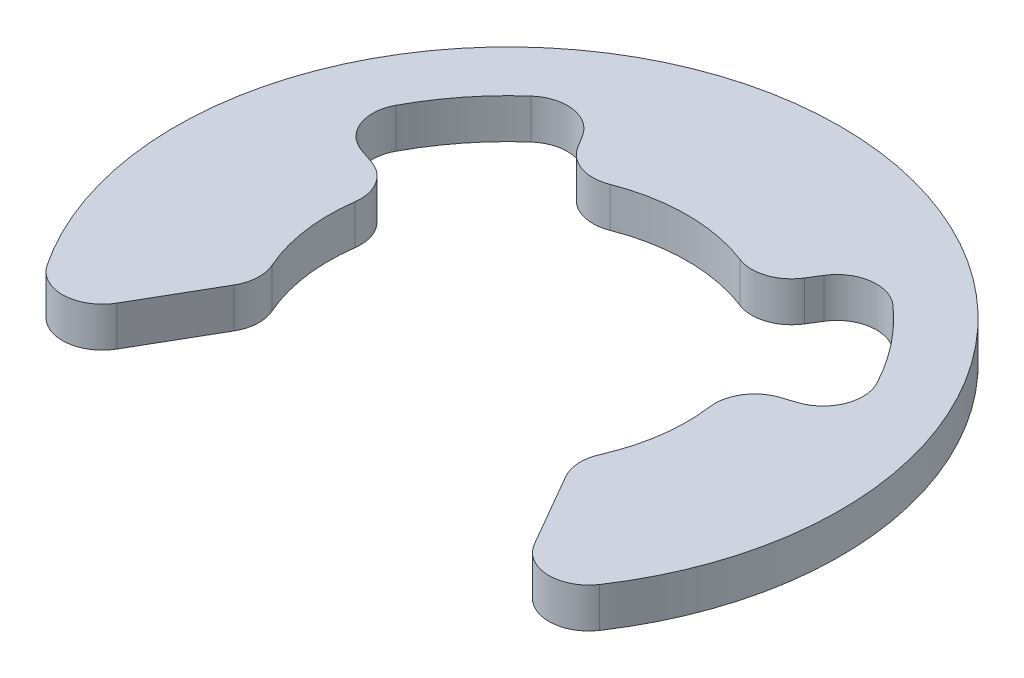
from build123d import *

# Parameters (mm, degrees)
EXTRUDE_1_DEPTH = 1


with BuildPart() as part:
    # 草图1 → 凸台-拉伸1 (new body)
    with BuildSketch(Plane(origin=(0, 0.5, 0), x_dir=(1, 0, 0), z_dir=(0, 1, 0))):
        with BuildLine():
            Line((-5.244767103, -4.584203097), (-4.167087077, -2.717606537))
            ThreePointArc((-4.167087077, -2.717606537), (-4.034585997, -2.271873104), (-4.118001121, -1.814405349))
            ThreePointArc((-4.118001121, -1.814405349), (-4.456198609, -0.626333745), (-4.458609609, 0.608933782))
            ThreePointArc((-4.458609609, 0.608933782), (-4.601226006, 1.273951326), (-5.136202752, 1.693936625))
            Line((-5.136202752, 1.693936625), (-5.473881344, 1.805304139))
            ThreePointArc((-5.473881344, 1.805304139), (-6.088989364, 2.383198742), (-6.042838565, 3.225926546))
            ThreePointArc((-6.042838565, 3.225926546), (-5.379219194, 4.2410495), (-4.546979081, 5.123229571))
            ThreePointArc((-4.546979081, 5.123229571), (-3.738286616, 5.364759165), (-3.032809253, 4.901486309))
            Line((-3.032809253, 4.901486309), (-2.845718103, 4.599118228))
            ThreePointArc((-2.845718103, 4.599118228), (-2.312489364, 4.176915809), (-1.632551598, 4.193420475))
            ThreePointArc((-1.632551598, 4.193420475), (0, 4.5), (1.632551598, 4.193420475))
            ThreePointArc((1.632551598, 4.193420475), (2.312489364, 4.176915809), (2.845718103, 4.599118228))
            Line((2.845718103, 4.599118228), (3.032809253, 4.901486309))
            ThreePointArc((3.032809253, 4.901486309), (3.738286616, 5.364759165), (4.546979081, 5.123229571))
            ThreePointArc((4.546979081, 5.123229571), (5.379219194, 4.2410495), (6.042838565, 3.225926546))
            ThreePointArc((6.042838565, 3.225926546), (6.088989364, 2.383198742), (5.473881344, 1.805304139))
            Line((5.473881344, 1.805304139), (5.136202752, 1.693936625))
            ThreePointArc((5.136202752, 1.693936625), (4.601226006, 1.273951326), (4.458609609, 0.608933782))
            ThreePointArc((4.458609609, 0.608933782), (4.456198609, -0.626333745), (4.118001121, -1.814405349))
            ThreePointArc((4.118001121, -1.814405349), (4.034585997, -2.271873104), (4.167087077, -2.717606537))
            Line((4.167087077, -2.717606537), (5.244767103, -4.584203097))
            ThreePointArc((5.244767103, -4.584203097), (6.078011121, -5.083665643), (6.942192848, -4.639876987))
            ThreePointArc((6.942192848, -4.639876987), (0, 8.35), (-6.942192848, -4.639876987))
            ThreePointArc((-6.942192848, -4.639876987), (-6.078011121, -5.083665643), (-5.244767103, -4.584203097))
        make_face()
    extrude(amount=-EXTRUDE_1_DEPTH)


solid = part.part
